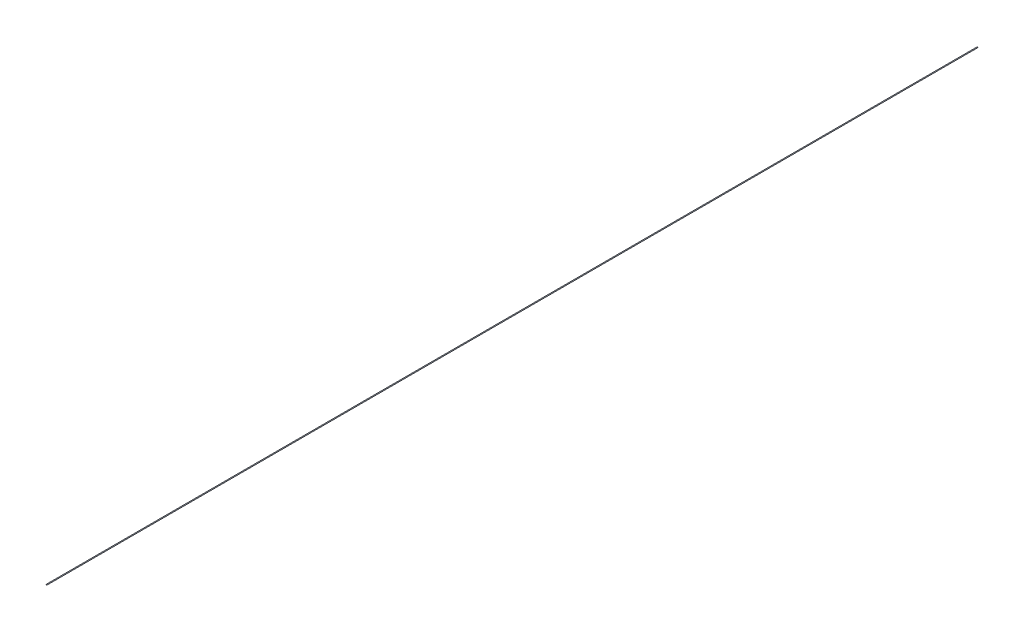
from build123d import *

# Parameters (mm, degrees)
SKETCH1_R      = 3.175
EXTRUDE1_DEPTH = 7620


with BuildPart() as part:
    # Sketch1 → Extrude1 (new body)
    with BuildSketch(Plane.XY):
        with Locations(Location((0, 0, 0), (0, 0, 180))):
            Circle(SKETCH1_R)
    extrude(amount=EXTRUDE1_DEPTH)


solid = part.part
